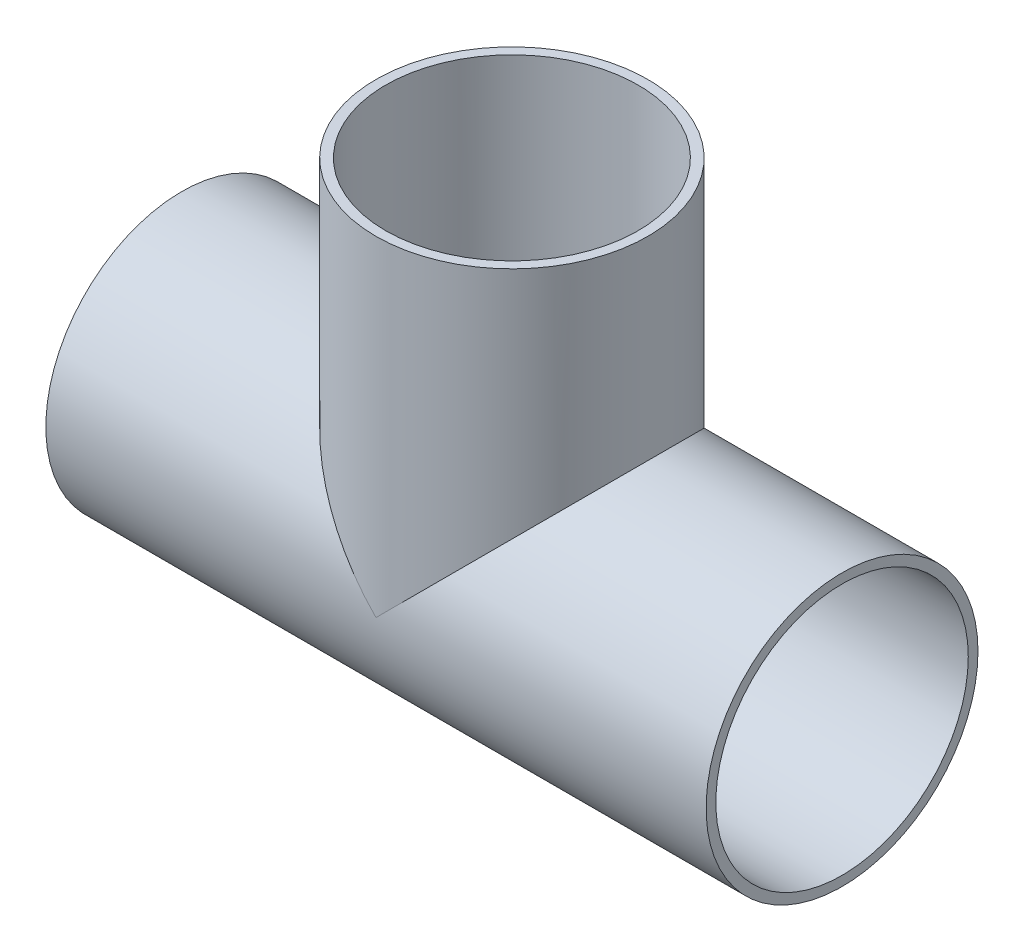
from build123d import *

# Parameters (mm, degrees)
SKETCH1_R           = 35
SKETCH1_R_2         = 32.5
BOSS_EXTRUDE1_DEPTH = 170
SKETCH2_R           = 35
SKETCH2_R_2         = 32.5
BOSS_EXTRUDE2_DEPTH = 85
SKETCH4_R           = 32.5
CUT_EXTRUDE2_DEPTH  = 170
SKETCH5_R           = 32.5
CUT_EXTRUDE4_DEPTH  = 85


with BuildPart() as part:
    # Sketch1 → Boss-Extrude1 (new body)
    with BuildSketch(Plane(origin=(0, 0, 0), x_dir=(0, 0, -1), z_dir=(1, 0, 0))):
        Circle(SKETCH1_R)
        Circle(SKETCH1_R_2, mode=Mode.SUBTRACT)
    extrude(amount=BOSS_EXTRUDE1_DEPTH)

    # Sketch2 → Boss-Extrude2 (add)
    with BuildSketch(Plane(origin=(0, 0, 0), x_dir=(1, 0, 0), z_dir=(0, 1, 0))):
        with Locations(Location((85, 0, 0), (0, 0, 270))):
            Circle(SKETCH2_R)
        with Locations(Location((85, 0, 0), (0, 0, 90))):
            Circle(SKETCH2_R_2, mode=Mode.SUBTRACT)
    extrude(amount=BOSS_EXTRUDE2_DEPTH)

    # Sketch4 → Cut-Extrude2 (cut)
    with BuildSketch(Plane(origin=(0, 0, 0), x_dir=(0, 0, -1), z_dir=(1, 0, 0))):
        Circle(SKETCH4_R)
    extrude(amount=CUT_EXTRUDE2_DEPTH, mode=Mode.SUBTRACT)

    # Sketch5 → Cut-Extrude4 (cut)
    with BuildSketch(Plane(origin=(0, 0, 0), x_dir=(1, 0, 0), z_dir=(0, 1, 0))):
        with Locations(Location((85, 0, 0), (0, 0, 270))):
            Circle(SKETCH5_R)
    extrude(amount=CUT_EXTRUDE4_DEPTH, mode=Mode.SUBTRACT)


solid = part.part
